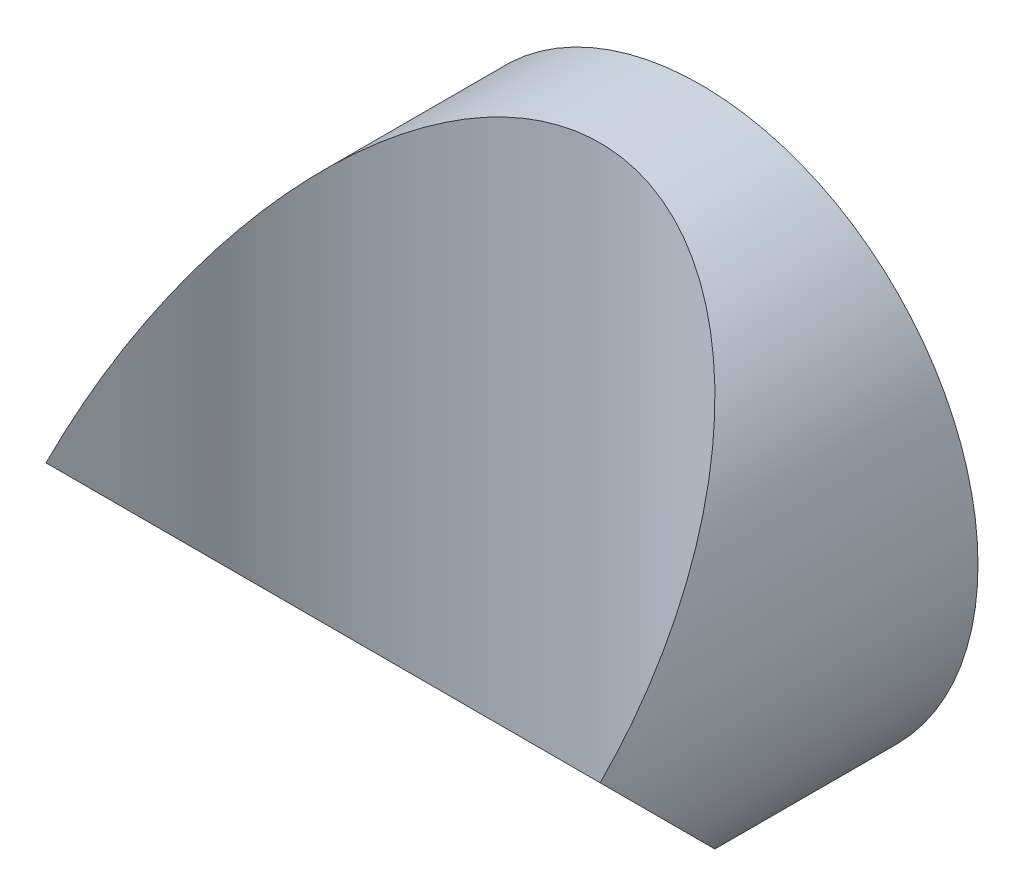
from build123d import *

# Parameters (mm, degrees)
SKETCH_1_R               = 20
EXTRUDE_1_DEPTH          = 27.27
CUT_EXTRUDE_1_DEPTH      = 20
CUT_EXTRUDE_1_DEPTH_BACK = 20
SKETCH_2_R               = 20


with BuildPart() as part:
    # 草图1 → 凸台-拉伸1 (new body)
    with BuildSketch(Plane.XY):
        Circle(SKETCH_1_R)
    extrude(amount=EXTRUDE_1_DEPTH)

    # 草图2 → 切除-拉伸1 (cut, two sides: drawn at the far end of the back side and taken through both)
    with BuildSketch(Plane(origin=(0, 0, 0), x_dir=(1, 0, 0), z_dir=(0, 1, 0)).offset(-CUT_EXTRUDE_1_DEPTH_BACK)):
        with Locations((0, -27.27)):
            Circle(SKETCH_2_R)
    extrude(amount=CUT_EXTRUDE_1_DEPTH + CUT_EXTRUDE_1_DEPTH_BACK, mode=Mode.SUBTRACT)


solid = part.part
